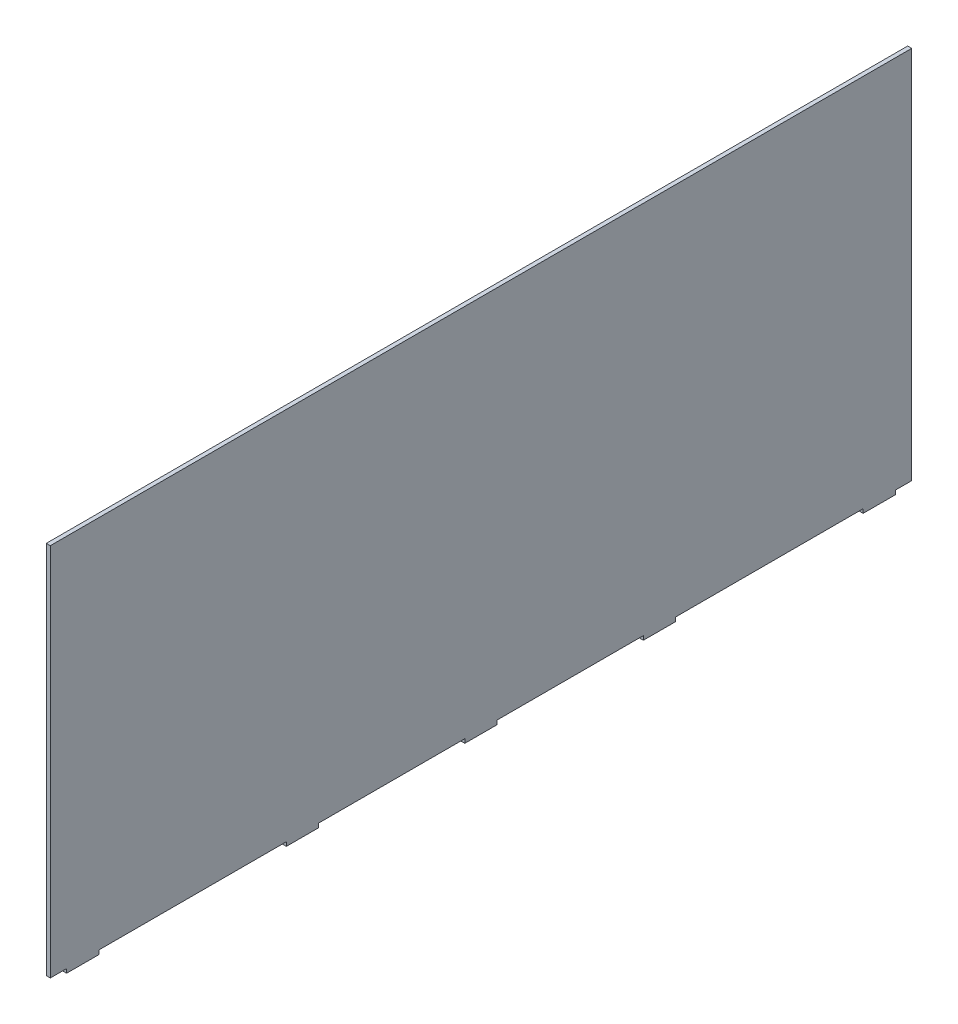
from build123d import *

# Parameters (mm, degrees)
SKETCH1_W           = 25.4
SKETCH1_H           = 3.175
BOSS_EXTRUDE1_DEPTH = 3.175


with BuildPart() as part:
    # Sketch1 → Boss-Extrude1 (new body)
    with BuildSketch(Plane(origin=(0, 0, 0), x_dir=(0, 0, -1), z_dir=(1, 0, 0))):
        Polygon((-12.7, -145.415), (12.7, -145.415), (127.47244, -145.415), (152.87244, -145.415), (300.04258, -145.415), (300.04258, -148.59), (325.44258, -148.59), (325.44258, -145.415), (338.201, -145.415), (338.201, 148.59), (-338.201, 148.59), (-338.201, -145.415), (-325.44258, -145.415), (-325.44258, -148.59), (-300.04258, -148.59), (-300.04258, -145.415), (-152.87244, -145.415), (-127.47244, -145.415), align=None)
        with Locations((0, -147.0025)):
            Rectangle(SKETCH1_W, SKETCH1_H)
        with Locations((-140.17244, -147.0025)):
            Rectangle(SKETCH1_W, SKETCH1_H)
        with Locations((140.17244, -147.0025)):
            Rectangle(SKETCH1_W, SKETCH1_H)
    extrude(amount=BOSS_EXTRUDE1_DEPTH)


solid = part.part
